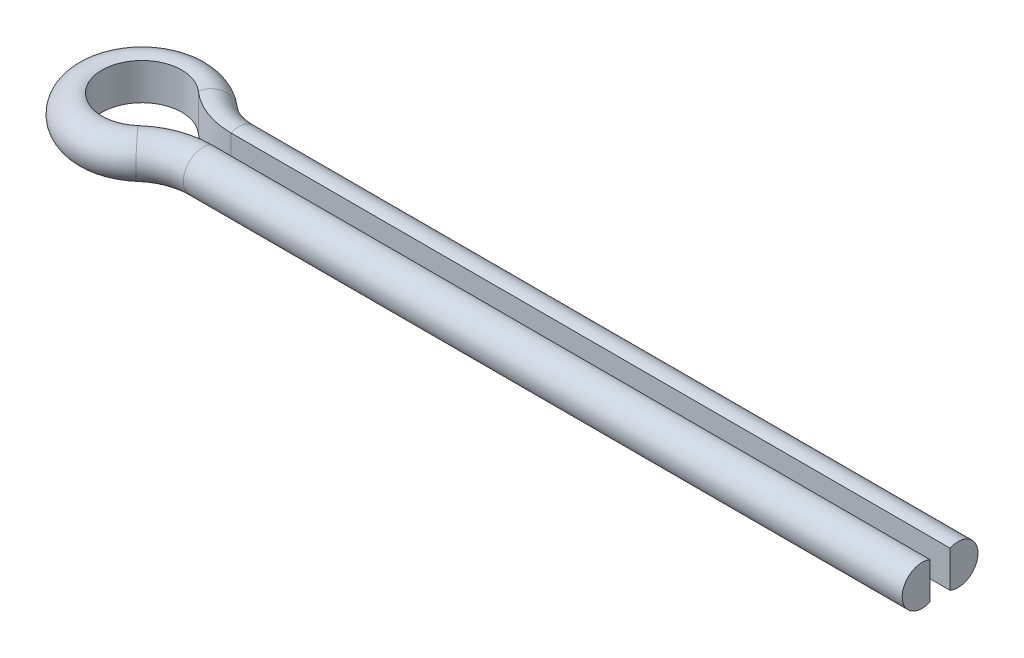
from build123d import *


with BuildPart() as part:
    # Sweep1: sweep along a path in Sketch2
    with BuildLine(Plane(origin=(0, 0, 0), x_dir=(1, 0, 0), z_dir=(0, 1, 0))) as sweep1_path:
        Line((100, -1.25), (9.921567416, -1.25))
        ThreePointArc((9.921567416, -1.25), (6.386033511, -1.895856533), (3.307189139, -3.75))
        ThreePointArc((3.307189139, -3.75), (-5, 0), (3.307189139, 3.75))
        ThreePointArc((3.307189139, 3.75), (6.386033511, 1.895856533), (9.921567416, 1.25))
        Line((9.921567416, 1.25), (100, 1.25))
    # Sketch3 → Sweep1 (sweep)
    with BuildSketch(Plane(origin=(100, 0, 0), x_dir=(0, 0, -1), z_dir=(1, 0, 0))):
        with BuildLine():
            Line((1.25, 2.291287847), (1.25, -2.291287847))
            ThreePointArc((1.25, -2.291287847), (4.75, 0), (1.25, 2.291287847))
        make_face()
    sweep(path=sweep1_path.line)


solid = part.part
